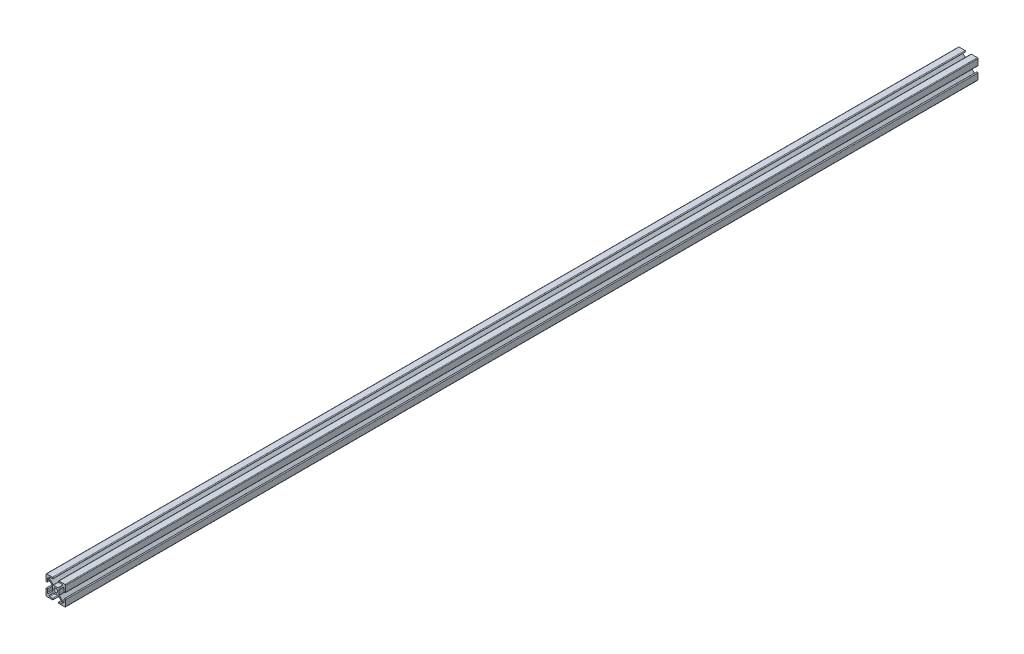
from build123d import *

# Parameters (mm, degrees)
SALIENTE_EXTRUIR1_DEPTH = 1400
CROQUIS2_R              = 3
CORTAR_EXTRUIR1_DEPTH   = 1401.160705062
CORTAR_EXTRUIR3_DEPTH   = 1401.160705062


with BuildPart() as part:
    # Croquis1 → Saliente-Extruir1 (new body)
    with BuildSketch(Plane.XY):
        with BuildLine():
            Line((-14, 15), (14, 15))
            ThreePointArc((14, 15), (14.707106781, 14.707106781), (15, 14))
            Line((15, 14), (15, -14))
            ThreePointArc((15, -14), (14.707106781, -14.707106781), (14, -15))
            Line((14, -15), (-14, -15))
            ThreePointArc((-14, -15), (-14.707106781, -14.707106781), (-15, -14))
            Line((-15, -14), (-15, 14))
            ThreePointArc((-15, 14), (-14.707106781, 14.707106781), (-14, 15))
        make_face()
    extrude(amount=-SALIENTE_EXTRUIR1_DEPTH)

    # Croquis2 → Cortar-Extruir1 (cut, through all)
    with BuildSketch(Plane.XY):
        Circle(CROQUIS2_R)
    extrude(amount=-CORTAR_EXTRUIR1_DEPTH, mode=Mode.SUBTRACT)

    # Croquis3 → Cortar-Extruir3 (cut, through all)
    with BuildSketch(Plane.XY):
        with BuildLine():
            Line((-5.492893219, 4.078679656), (-11.292893219, 9.878679656))
            ThreePointArc((-11.292893219, 9.878679656), (-12.382683432, 10.095452408), (-13, 9.171572875))
            Line((-13, 9.171572875), (-13, 5))
            ThreePointArc((-13, 5), (-14, 4), (-15, 5))
            Line((-15, 5), (-15, -5))
            ThreePointArc((-15, -5), (-14, -4), (-13, -5))
            Line((-13, -5), (-13, -9.171572875))
            ThreePointArc((-13, -9.171572875), (-12.382683432, -10.095452408), (-11.292893219, -9.878679656))
            Line((-11.292893219, -9.878679656), (-5.492893219, -4.078679656))
            ThreePointArc((-5.492893219, -4.078679656), (-5.276120467, -3.754256308), (-5.2, -3.371572875))
            Line((-5.2, -3.371572875), (-5.2, 3.371572875))
            ThreePointArc((-5.2, 3.371572875), (-5.276120467, 3.754256308), (-5.492893219, 4.078679656))
        make_face()
        with BuildLine():
            ThreePointArc((-9.171572875, 13), (-10.095452408, 12.382683432), (-9.878679656, 11.292893219))
            Line((-9.878679656, 11.292893219), (-4.078679656, 5.492893219))
            ThreePointArc((-4.078679656, 5.492893219), (-3.754256308, 5.276120467), (-3.371572875, 5.2))
            Line((-3.371572875, 5.2), (3.371572875, 5.2))
            ThreePointArc((3.371572875, 5.2), (3.754256308, 5.276120467), (4.078679656, 5.492893219))
            Line((4.078679656, 5.492893219), (9.878679656, 11.292893219))
            ThreePointArc((9.878679656, 11.292893219), (10.095452408, 12.382683432), (9.171572875, 13))
            Line((9.171572875, 13), (5, 13))
            ThreePointArc((5, 13), (4, 14), (5, 15))
            Line((5, 15), (-5, 15))
            ThreePointArc((-5, 15), (-4.292893219, 14.707106781), (-4, 14))
            ThreePointArc((-4, 14), (-4.292893219, 13.292893219), (-5, 13))
            Line((-5, 13), (-9.171572875, 13))
        make_face()
        with BuildLine():
            Line((9.878679656, -11.292893219), (4.078679656, -5.492893219))
            ThreePointArc((4.078679656, -5.492893219), (3.754256308, -5.276120467), (3.371572875, -5.2))
            Line((3.371572875, -5.2), (-3.371572875, -5.2))
            ThreePointArc((-3.371572875, -5.2), (-3.754256308, -5.276120467), (-4.078679656, -5.492893219))
            Line((-4.078679656, -5.492893219), (-9.878679656, -11.292893219))
            ThreePointArc((-9.878679656, -11.292893219), (-10.095452408, -12.382683432), (-9.171572875, -13))
            Line((-9.171572875, -13), (-5, -13))
            ThreePointArc((-5, -13), (-4.292893219, -13.292893219), (-4, -14))
            ThreePointArc((-4, -14), (-4.292893219, -14.707106781), (-5, -15))
            Line((-5, -15), (5, -15))
            ThreePointArc((5, -15), (4, -14), (5, -13))
            Line((5, -13), (9.171572875, -13))
            ThreePointArc((9.171572875, -13), (10.095452408, -12.382683432), (9.878679656, -11.292893219))
        make_face()
        with BuildLine():
            ThreePointArc((13, 9.171572875), (12.382683432, 10.095452408), (11.292893219, 9.878679656))
            Line((11.292893219, 9.878679656), (5.492893219, 4.078679656))
            ThreePointArc((5.492893219, 4.078679656), (5.276120467, 3.754256308), (5.2, 3.371572875))
            Line((5.2, 3.371572875), (5.2, -3.371572875))
            ThreePointArc((5.2, -3.371572875), (5.276120467, -3.754256308), (5.492893219, -4.078679656))
            Line((5.492893219, -4.078679656), (11.292893219, -9.878679656))
            ThreePointArc((11.292893219, -9.878679656), (12.382683432, -10.095452408), (13, -9.171572875))
            Line((13, -9.171572875), (13, -5))
            ThreePointArc((13, -5), (14, -4), (15, -5))
            Line((15, -5), (15, 5))
            ThreePointArc((15, 5), (14, 4), (13, 5))
            Line((13, 5), (13, 9.171572875))
        make_face()
    extrude(amount=-CORTAR_EXTRUIR3_DEPTH, mode=Mode.SUBTRACT)


solid = part.part
